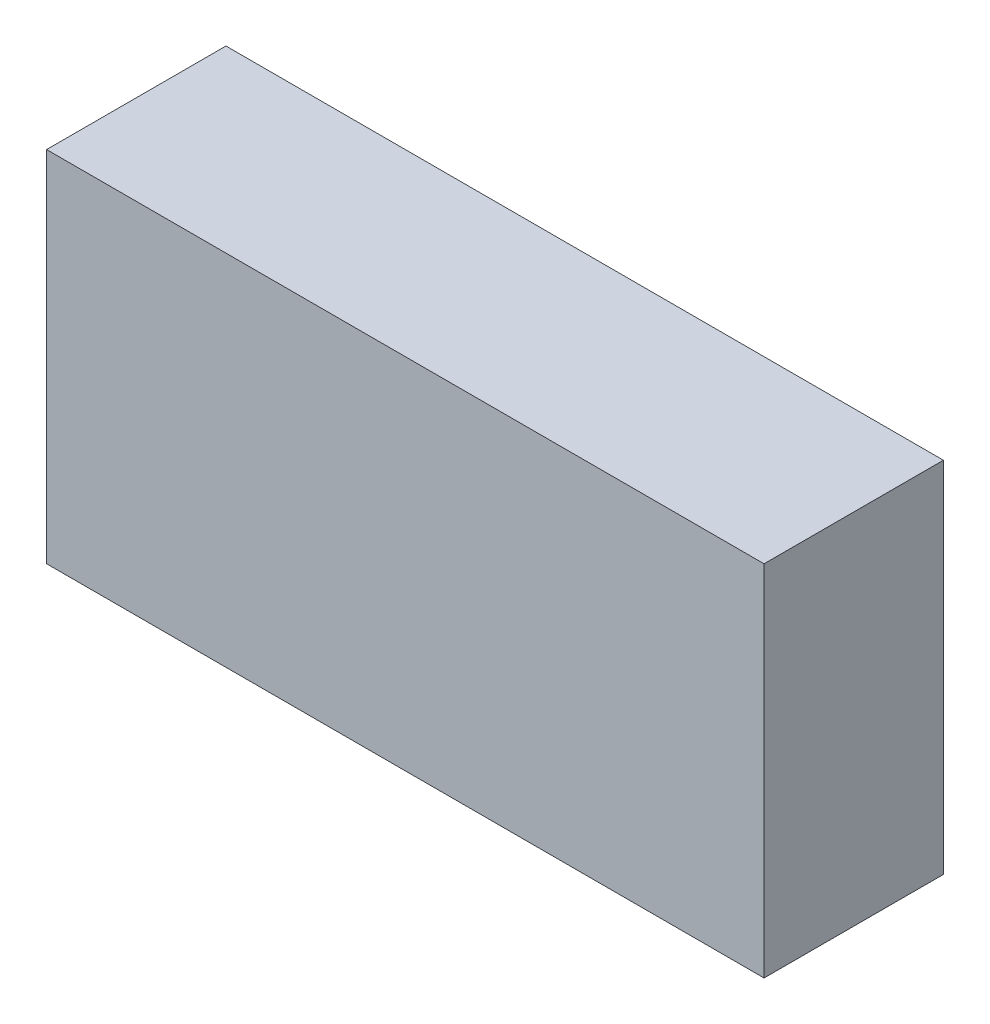
from build123d import *

# Parameters (mm, degrees)
SKETCH1_W               = 4
SKETCH1_H               = 2
COMPONENT_OUTLINE_DEPTH = 1


with BuildPart() as part:
    # Sketch1 → Component_Outline (new body)
    with BuildSketch(Plane.XY):
        Rectangle(SKETCH1_W, SKETCH1_H)
    extrude(amount=COMPONENT_OUTLINE_DEPTH)


solid = part.part
